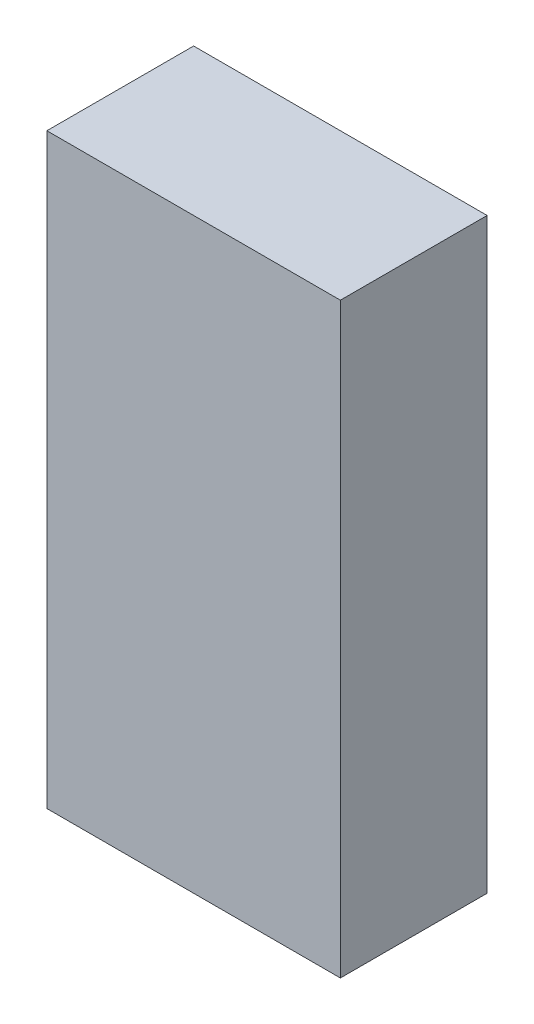
from build123d import *

# Parameters (mm, degrees)
ESBO_O1_W                = 30
ESBO_O1_H                = 60
RESSALTO_EXTRUS_O1_DEPTH = 7.5


with BuildPart() as part:
    # Esboço1 → Ressalto-extrusão1 (new, symmetric)
    with BuildSketch(Plane.XY):
        Rectangle(ESBO_O1_W, ESBO_O1_H)
    extrude(amount=RESSALTO_EXTRUS_O1_DEPTH, both=True)


solid = part.part
